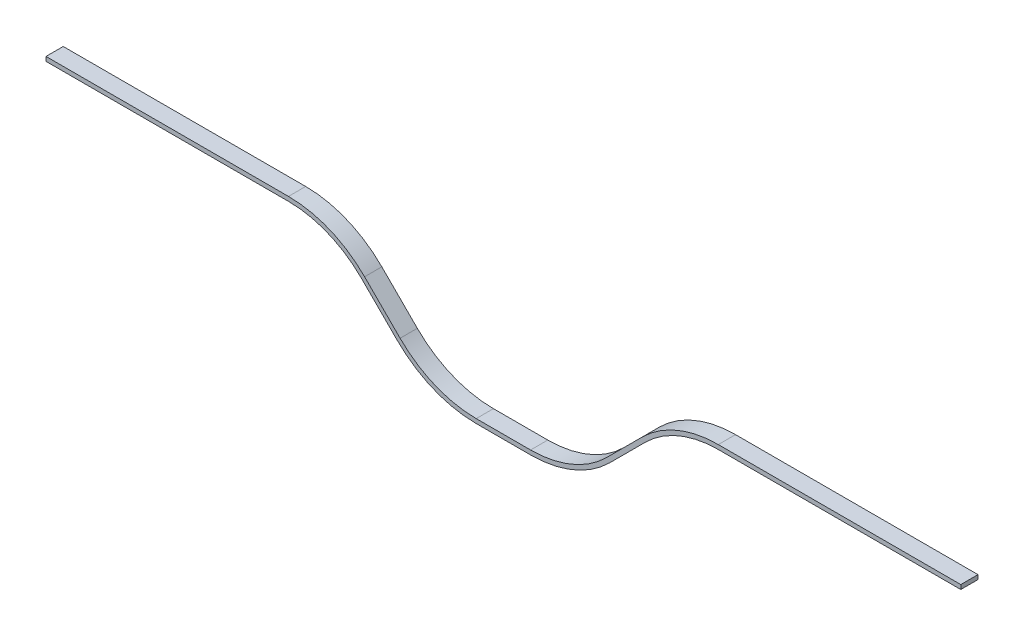
from build123d import *

# Parameters (mm, degrees)
SALIENTE_EXTRUIR1_DEPTH = 120


with BuildPart() as part:
    # Croquis1 → Saliente-Extruir1 (new body)
    with BuildSketch(Plane.XY):
        with BuildLine():
            Line((0, 0), (1689.33982822, 0))
            ThreePointArc((1689.33982822, 0), (1976.352402494, -57.090350617), (2219.66991411, -219.66991411))
            Line((2219.66991411, -219.66991411), (2466.975964055, -466.975964055))
            ThreePointArc((2466.975964055, -466.975964055), (2710.293475671, -629.555527548), (2997.306049945, -686.645878165))
            Line((2997.306049945, -686.645878165), (3375.985706385, -686.645878165))
            ThreePointArc((3375.985706385, -686.645878165), (3662.998280659, -629.555527548), (3906.315792275, -466.975964055))
            Line((3906.315792275, -466.975964055), (4153.62184222, -219.66991411))
            ThreePointArc((4153.62184222, -219.66991411), (4396.939353836, -57.090350617), (4683.95192811, 0))
            Line((4683.95192811, 0), (6373.29175633, 0))
            Line((6373.29175633, 0), (6373.29175633, -30))
            Line((6373.29175633, -30), (4683.95192811, -30))
            ThreePointArc((4683.95192811, -30), (4408.419856807, -84.806736592), (4174.835045655, -240.883117546))
            Line((4174.835045655, -240.883117546), (3927.528995711, -488.18916749))
            ThreePointArc((3927.528995711, -488.18916749), (3674.47878363, -657.271913524), (3375.985706385, -716.645878165))
            Line((3375.985706385, -716.645878165), (2997.306049945, -716.645878165))
            ThreePointArc((2997.306049945, -716.645878165), (2698.8129727, -657.271913524), (2445.762760619, -488.18916749))
            Line((2445.762760619, -488.18916749), (2198.456710674, -240.883117546))
            ThreePointArc((2198.456710674, -240.883117546), (1964.871899523, -84.806736592), (1689.33982822, -30))
            Line((1689.33982822, -30), (0, -30))
            Line((0, -30), (0, 0))
        make_face()
    extrude(amount=SALIENTE_EXTRUIR1_DEPTH)


solid = part.part
